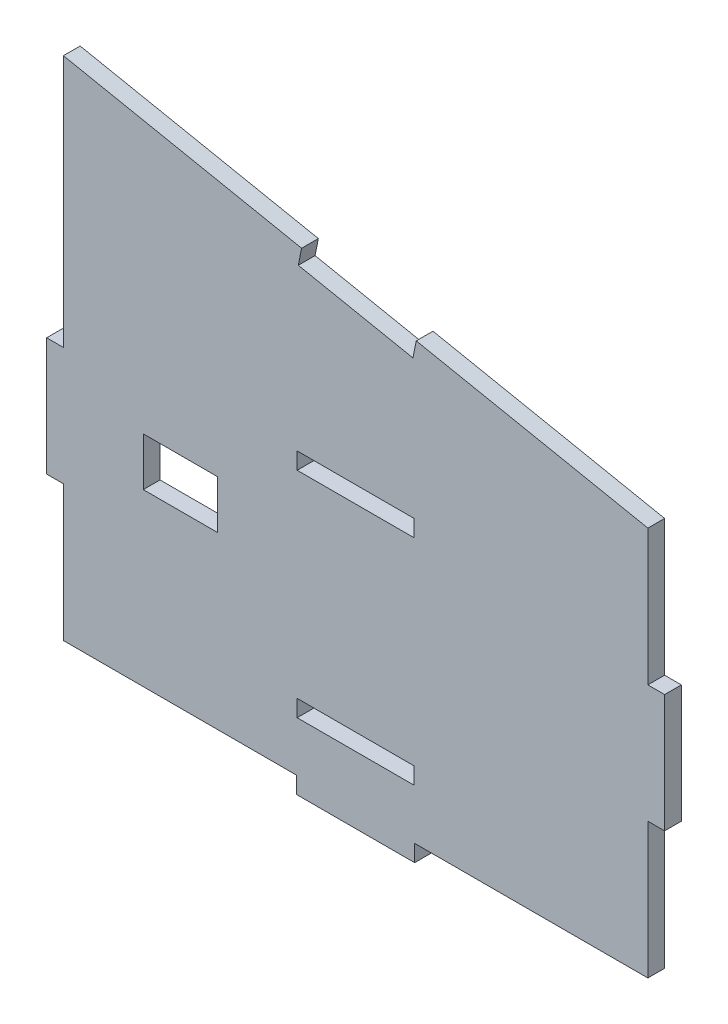
from build123d import *

# Parameters (mm, degrees)
SKETCH1_W           = 30
SKETCH1_H           = 4.3
SKETCH1_W_2         = 19
SKETCH1_H_2         = 12.4
BOSS_EXTRUDE1_DEPTH = 4.3


with BuildPart() as part:
    # Sketch1 → Boss-Extrude1 (new body)
    with BuildSketch(Plane.XY):
        Polygon((0, 130), (0, 65.15), (-4.3, 65.15), (-4.3, 34.85), (0, 34.85), (0, 0), (59.85, 0), (59.85, -4.3), (90.15, -4.3), (90.15, 0), (150, 0), (150, 34.85), (154.3, 34.85), (154.3, 65.15), (150, 65.15), (150, 100), (90.552009516, 111.889598097), (89.708710135, 107.673101191), (60.291289865, 113.556585245), (61.134589246, 117.773082151), align=None)
        with Locations((75, 15)):
            Rectangle(SKETCH1_W, SKETCH1_H, mode=Mode.SUBTRACT)
        with Locations((75, 70)):
            Rectangle(SKETCH1_W, SKETCH1_H, mode=Mode.SUBTRACT)
        with Locations((30, 50)):
            Rectangle(SKETCH1_W_2, SKETCH1_H_2, mode=Mode.SUBTRACT)
    extrude(amount=BOSS_EXTRUDE1_DEPTH)


solid = part.part
